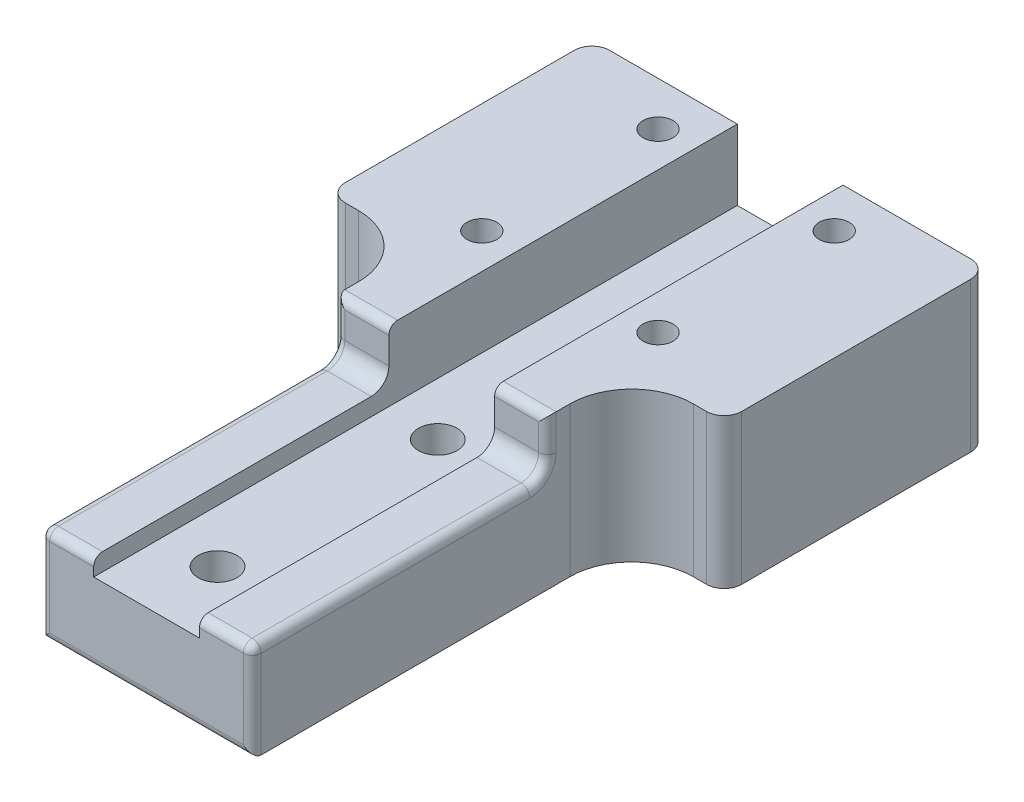
from build123d import *

# Parameters (mm, degrees)
SKETCH1_W           = 45
SKETCH1_H           = 30
SKETCH1_R           = 1.7
SKETCH1_W_2         = 24
SKETCH1_H_2         = 43.058371989
SKETCH1_R_2         = 2.2
BOSS_EXTRUDE2_DEPTH = 17
SKETCH5_W           = 12
SKETCH5_H           = 100
CUT_EXTRUDE1_DEPTH  = 8
SKETCH7_W           = 29.697028674
SKETCH7_H           = 34.988499238
CUT_EXTRUDE2_DEPTH  = 64.229934035
FILLET1_R           = 7
FILLET6_R           = 2
FILLET7_R           = 1


with BuildPart() as part:
    # Sketch1 → Boss-Extrude2 (new body)
    # profile 1 of 2: a face of its own
    with BuildSketch(Plane(origin=(0, 0, 0), x_dir=(1, 0, 0), z_dir=(0, 1, 0))):
        Rectangle(SKETCH1_W, SKETCH1_H)
        with Locations(Location((-10, 10, 0), (0, 0, 270))):
            Circle(SKETCH1_R, mode=Mode.SUBTRACT)
        with Locations(Location((10, 10, 0), (0, 0, 270))):
            Circle(SKETCH1_R, mode=Mode.SUBTRACT)
        with Locations(Location((10, -10, 0), (0, 0, 270))):
            Circle(SKETCH1_R, mode=Mode.SUBTRACT)
        with Locations(Location((-10, -10, 0), (0, 0, 270))):
            Circle(SKETCH1_R, mode=Mode.SUBTRACT)
    # profile 2 of 2: a face of its own
    with BuildSketch(Plane(origin=(0, 0, 0), x_dir=(1, 0, 0), z_dir=(0, 1, 0))):
        with Locations((0, -36.529185995)):
            Rectangle(SKETCH1_W_2, SKETCH1_H_2)
        with Locations(Location((0, -25, 0), (0, 0, 270))):
            Circle(SKETCH1_R_2, mode=Mode.SUBTRACT)
        with Locations(Location((0, -50, 0), (0, 0, 270))):
            Circle(SKETCH1_R_2, mode=Mode.SUBTRACT)
    extrude(amount=-BOSS_EXTRUDE2_DEPTH)

    # Sketch5 → Cut-Extrude1 (cut)
    with BuildSketch(Plane(origin=(0, 0, 0), x_dir=(1, 0, 0), z_dir=(0, 1, 0))):
        with Locations((0, -16.465194583)):
            Rectangle(SKETCH5_W, SKETCH5_H)
    extrude(amount=-CUT_EXTRUDE1_DEPTH, mode=Mode.SUBTRACT)

    # Sketch7 → Cut-Extrude2 (cut, through all)
    with BuildSketch(Plane(origin=(0, -6, 0), x_dir=(1, 0, 0), z_dir=(0, 1, 0))):
        with Locations((-0.809918964, -42.047133079)):
            Rectangle(SKETCH7_W, SKETCH7_H)
    extrude(amount=CUT_EXTRUDE2_DEPTH, mode=Mode.SUBTRACT)

    # Fillet1
    fillet1_edges = [part.edges().sort_by_distance(p)[0] for p in [
        (-12, -8.5, 15),
        (12, -8.5, 15),
    ]]
    fillet(fillet1_edges, radius=FILLET1_R)

    # Fillet6
    fillet6_edges = [part.edges().sort_by_distance(p)[0] for p in [
        (22.5, -8.5, 15),
        (-22.5, -8.5, 15),
        (-22.5, -8.5, -15),
        (22.5, -8.5, -15),
        (9, -6, 24.55288346),
        (-9, -6, 24.55288346),
    ]]
    fillet(fillet6_edges, radius=FILLET6_R)

    # Fillet7
    fillet7_edges = [part.edges().sort_by_distance(p)[0] for p in [
        (-12, -2, 24.55288346),
        (12, -2, 24.55288346),
        (-12, -5.414213562, 25.138669897),
        (12, -5.414213562, 25.138669897),
        (-12, -11.5, 58.058371989),
        (12, -11.5, 58.058371989),
        (0, -17, 58.058371989),
        (9, 0, 24.55288346),
        (9, -6, 58.058371989),
        (12, -6, 42.305627724),
        (-9, 0, 24.55288346),
        (-9, -6, 58.058371989),
        (-12, -6, 42.305627724),
    ]]
    fillet(fillet7_edges, radius=FILLET7_R)


solid = part.part
